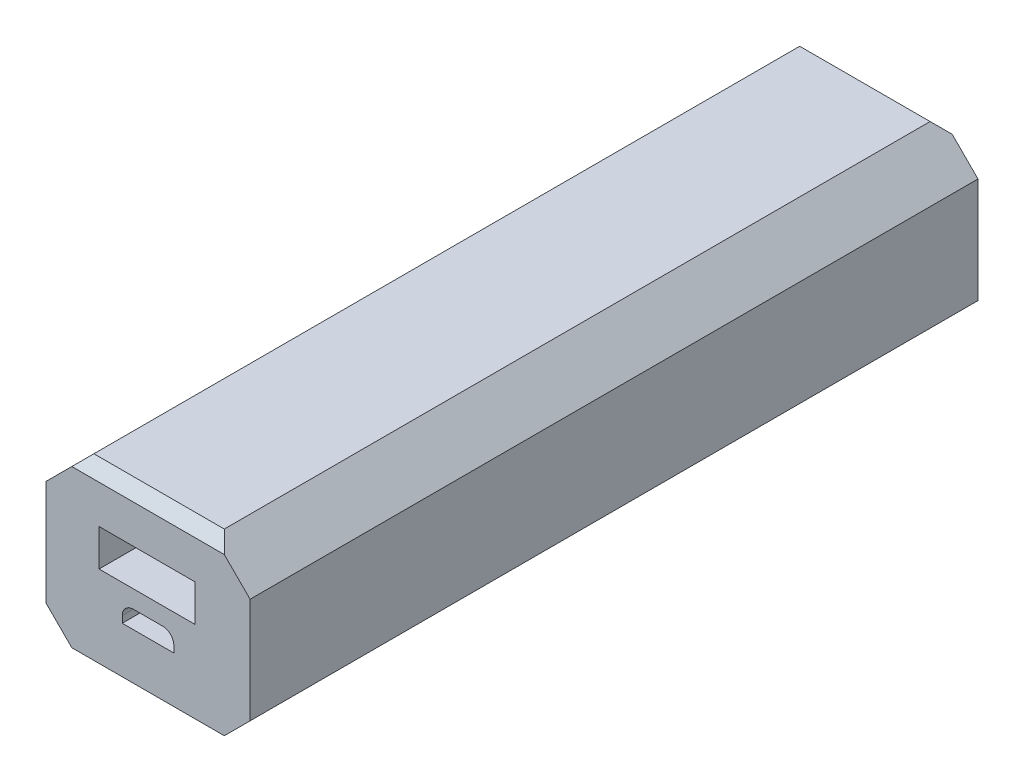
from build123d import *

# Parameters (mm, degrees)
SKETCH1_W           = 27.7
SKETCH1_H           = 24.3
BOSS_EXTRUDE1_DEPTH = 98.8
CHAMFER1_SIZE       = 5
CHAMFER2_SIZE       = 1.5
SKETCH2_W           = 13
SKETCH2_H           = 5
CUT_EXTRUDE1_DEPTH  = 15
SKETCH3_W           = 7
SKETCH3_H           = 2.4
CUT_EXTRUDE3_DEPTH  = 10
FILLET1_R           = 1.5


with BuildPart() as part:
    # Sketch1 → Boss-Extrude1 (new body)
    with BuildSketch(Plane.XY):
        with Locations((13.85, 12.15)):
            Rectangle(SKETCH1_W, SKETCH1_H)
    extrude(amount=BOSS_EXTRUDE1_DEPTH)

    # Chamfer1
    chamfer1_edges = [part.edges().sort_by_distance(p)[0] for p in [
        (0, 24.3, 49.4),
        (27.7, 24.3, 49.4),
        (27.7, 0, 49.4),
        (0, 0, 49.4),
    ]]
    chamfer(chamfer1_edges, length=CHAMFER1_SIZE)

    # Chamfer2
    chamfer2_edges = [part.edges().sort_by_distance(p)[0] for p in [
        (13.85, 24.3, 0),
        (13.85, 0, 0),
        (13.85, 24.3, 98.8),
        (13.85, 0, 98.8),
    ]]
    chamfer(chamfer2_edges, length=CHAMFER2_SIZE)

    # Sketch2 → Cut-Extrude1 (cut)
    with BuildSketch(Plane.XY.offset(98.8)):
        with Locations((13.7, 15.100435324)):
            Rectangle(SKETCH2_W, SKETCH2_H)
    extrude(amount=-CUT_EXTRUDE1_DEPTH, mode=Mode.SUBTRACT)

    # Sketch3 → Cut-Extrude3 (cut)
    with BuildSketch(Plane.XY.offset(98.8)):
        with Locations((13.85, 9.000435324)):
            Rectangle(SKETCH3_W, SKETCH3_H)
    extrude(amount=-CUT_EXTRUDE3_DEPTH, mode=Mode.SUBTRACT)

    # Fillet1
    fillet1_edges = [part.edges().sort_by_distance(p)[0] for p in [
        (10.35, 10.200435324, 93.8),
        (17.35, 10.200435324, 93.8),
    ]]
    fillet(fillet1_edges, radius=FILLET1_R)


solid = part.part
